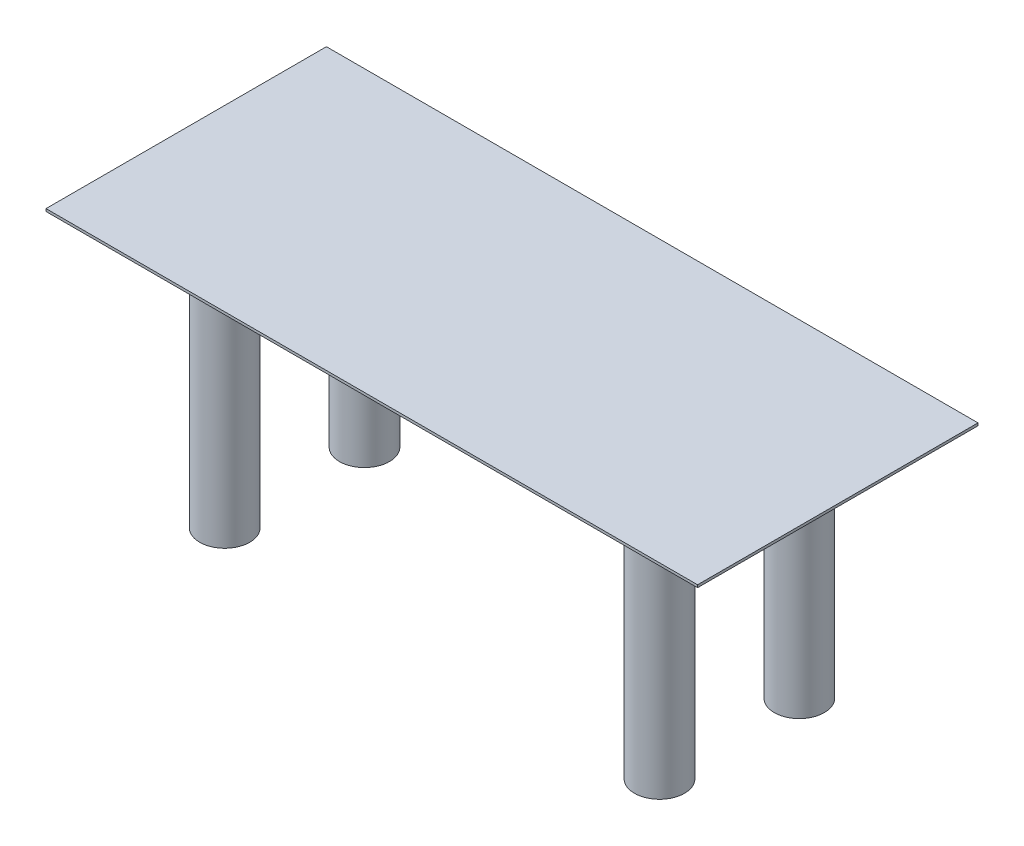
from build123d import *

# Parameters (mm, degrees)
SKETCH_1_W      = 2556
SKETCH_1_H      = 1100
EXTRUDE_1_DEPTH = 10
SKETCH_2_R      = 98.177549011
EXTRUDE_2_DEPTH = 1000


with BuildPart() as part:
    # 스케치1 → 보스-돌출1 (new body)
    with BuildSketch(Plane(origin=(0, 0, 0), x_dir=(1, 0, 0), z_dir=(0, 1, 0))):
        Rectangle(SKETCH_1_W, SKETCH_1_H)
    extrude(amount=EXTRUDE_1_DEPTH)

    # 스케치2 → 보스-돌출2 (add)
    with BuildSketch(Plane(origin=(0, 0, 0), x_dir=(-1, 0, 0), z_dir=(0, -1, 0))):
        with Locations(Location((852.850283956, -274.184066796, 0), (0, 0, 270))):
            Circle(SKETCH_2_R)
        with Locations(Location((-852.850283956, -274.184066796, 0), (0, 0, 270))):
            Circle(SKETCH_2_R)
        with Locations(Location((-852.850283956, 274.184066796, 0), (0, 0, 270))):
            Circle(SKETCH_2_R)
        with Locations(Location((852.850283956, 274.184066796, 0), (0, 0, 270))):
            Circle(SKETCH_2_R)
    extrude(amount=EXTRUDE_2_DEPTH)


solid = part.part
